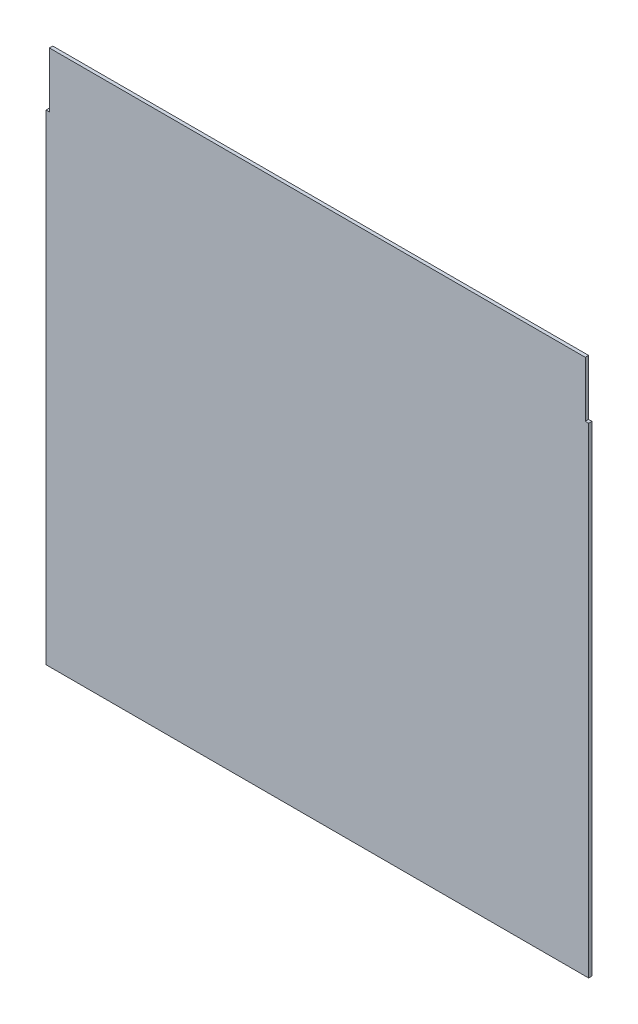
from build123d import *

# Parameters (mm, degrees)
SKETCH1_W           = 508
SKETCH1_H           = 508
BOSS_EXTRUDE1_DEPTH = 3.175
SKETCH4_W           = 3.175
SKETCH4_H           = 455.45375
BOSS_EXTRUDE2_DEPTH = 3.175


with BuildPart() as part:
    # Sketch1 → Boss-Extrude1 (new body)
    with BuildSketch(Plane.XY):
        Rectangle(SKETCH1_W, SKETCH1_H)
    extrude(amount=BOSS_EXTRUDE1_DEPTH)

    # Sketch4 → Boss-Extrude2 (add)
    with BuildSketch(Plane.XY.offset(3.175)):
        with Locations((255.5875, -26.273125)):
            Rectangle(SKETCH4_W, SKETCH4_H)
        with Locations((-255.5875, -26.273125)):
            Rectangle(SKETCH4_W, SKETCH4_H)
    extrude(amount=-BOSS_EXTRUDE2_DEPTH)


solid = part.part
